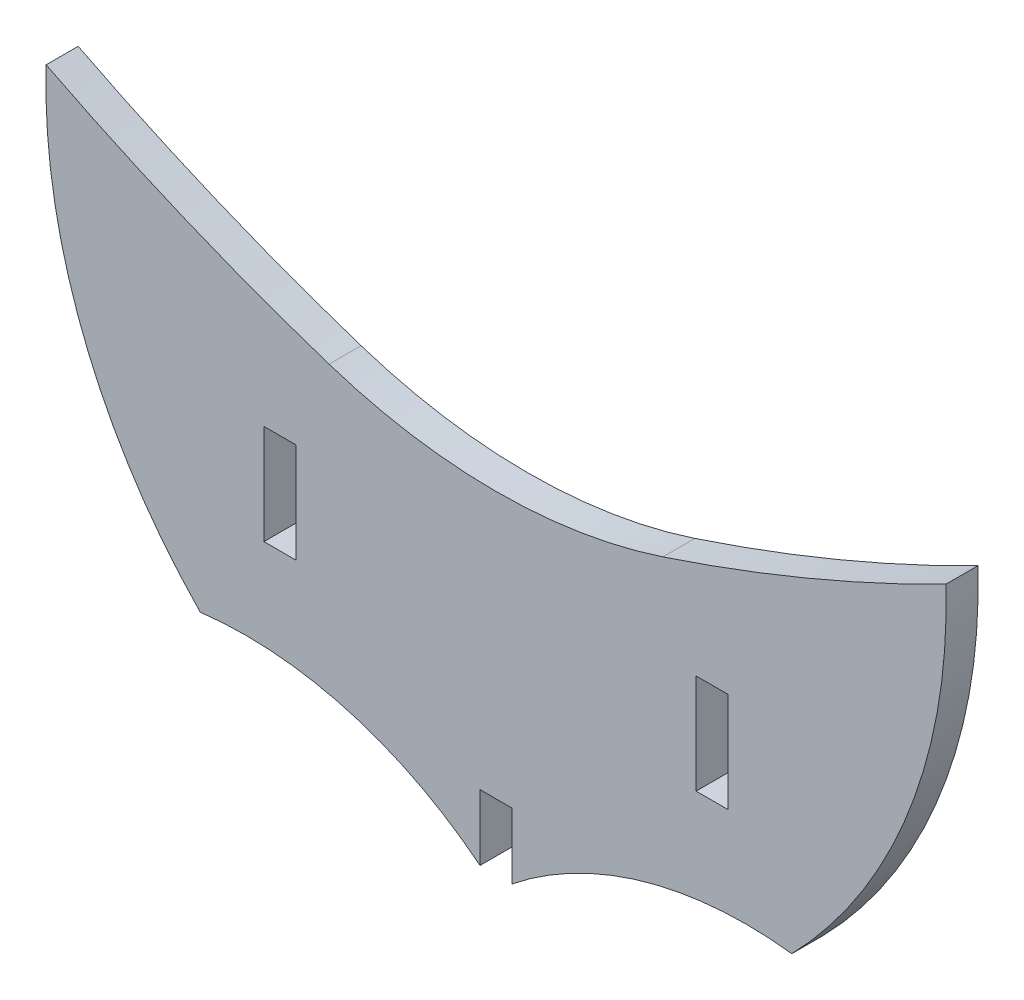
from build123d import *

# Parameters (mm, degrees)
BOSS_EXTRUDE1_DEPTH = 1.524
SKETCH2_W           = 1.524
SKETCH2_H           = 4.7498
CUT_EXTRUDE1_DEPTH  = 2.54


with BuildPart() as part:
    # Sketch1 → Boss-Extrude1 (new body)
    with BuildSketch(Plane.XY):
        with BuildLine():
            Line((-1.524, 17.137880282), (-1.524, 14.009051361))
            ThreePointArc((-1.524, 14.009051361), (-7.800379553, 17.247782791), (-14.842010982, 17.793446045))
            ThreePointArc((-14.842010982, 17.793446045), (-20.434373625, 26.496185152), (-22.17694037, 36.693030204))
            ThreePointArc((-22.17694037, 36.693030204), (-15.549040276, 33.631644025), (-8.706859323, 31.08493933))
            ThreePointArc((-8.706859323, 31.08493933), (-0.762, 29.81042814), (7.182859323, 31.08493933))
            ThreePointArc((7.182859323, 31.08493933), (14.025040276, 33.631644025), (20.65294037, 36.693030204))
            ThreePointArc((20.65294037, 36.693030204), (18.910373625, 26.496185152), (13.318010982, 17.793446045))
            ThreePointArc((13.318010982, 17.793446045), (6.276379553, 17.247782791), (0, 14.009051361))
            Line((0, 14.009051361), (0, 17.137880282))
            Line((0, 17.137880282), (-1.524, 17.137880282))
        make_face()
    extrude(amount=BOSS_EXTRUDE1_DEPTH)

    # Sketch2 → Cut-Extrude1 (cut)
    with BuildSketch(Plane.XY.offset(1.524)):
        with Locations((-11.049, 24.592780282)):
            Rectangle(SKETCH2_W, SKETCH2_H)
        with Locations((9.525, 24.592780282)):
            Rectangle(SKETCH2_W, SKETCH2_H)
    extrude(amount=-CUT_EXTRUDE1_DEPTH, mode=Mode.SUBTRACT)


solid = part.part
